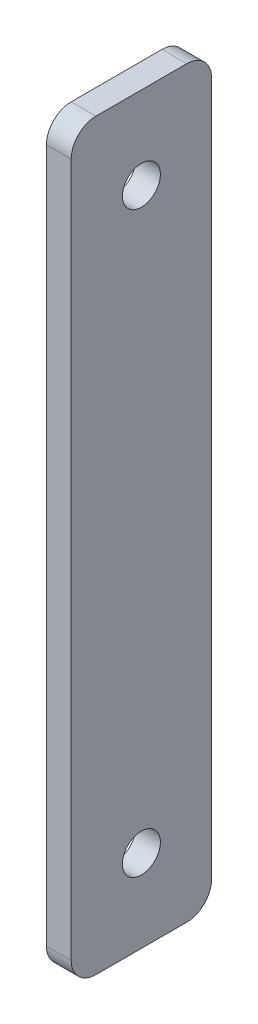
from build123d import *

# Parameters (mm, degrees)
SKETCH1_R           = 2.3
BOSS_EXTRUDE1_DEPTH = 3


with BuildPart() as part:
    # Sketch1 → Boss-Extrude1 (new body)
    with BuildSketch(Plane(origin=(0, 0, 0), x_dir=(0, 0, -1), z_dir=(1, 0, 0))):
        with BuildLine():
            Line((-5.5, 0), (5.5, 0))
            ThreePointArc((5.5, 0), (7.621320344, 0.878679656), (8.5, 3))
            Line((8.5, 3), (8.5, 87))
            ThreePointArc((8.5, 87), (7.621320344, 89.121320344), (5.5, 90))
            Line((5.5, 90), (-5.5, 90))
            ThreePointArc((-5.5, 90), (-7.621320344, 89.121320344), (-8.5, 87))
            Line((-8.5, 87), (-8.5, 3))
            ThreePointArc((-8.5, 3), (-7.621320344, 0.878679656), (-5.5, 0))
        make_face()
        with Locations((0, 10)):
            Circle(SKETCH1_R, mode=Mode.SUBTRACT)
        with Locations(Location((0, 80, 0), (0, 0, 180))):
            Circle(SKETCH1_R, mode=Mode.SUBTRACT)
    extrude(amount=BOSS_EXTRUDE1_DEPTH)


solid = part.part
